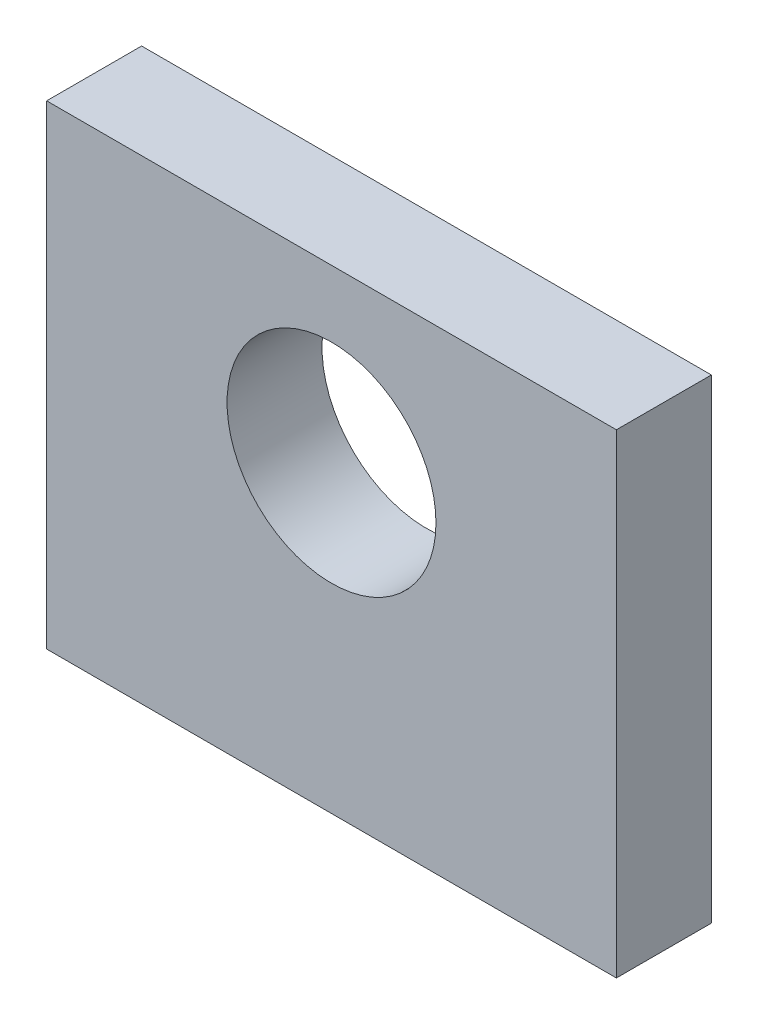
from build123d import *

# Parameters (mm, degrees)
CROQUIS1_W              = 60
CROQUIS1_H              = 50
CROQUIS1_R              = 11
SALIENTE_EXTRUIR1_DEPTH = 10


with BuildPart() as part:
    # Croquis1 → Saliente-Extruir1 (new body)
    with BuildSketch(Plane.XY):
        with Locations((30, 25)):
            Rectangle(CROQUIS1_W, CROQUIS1_H)
        with Locations((30, 32)):
            Circle(CROQUIS1_R, mode=Mode.SUBTRACT)
    extrude(amount=SALIENTE_EXTRUIR1_DEPTH)


solid = part.part
